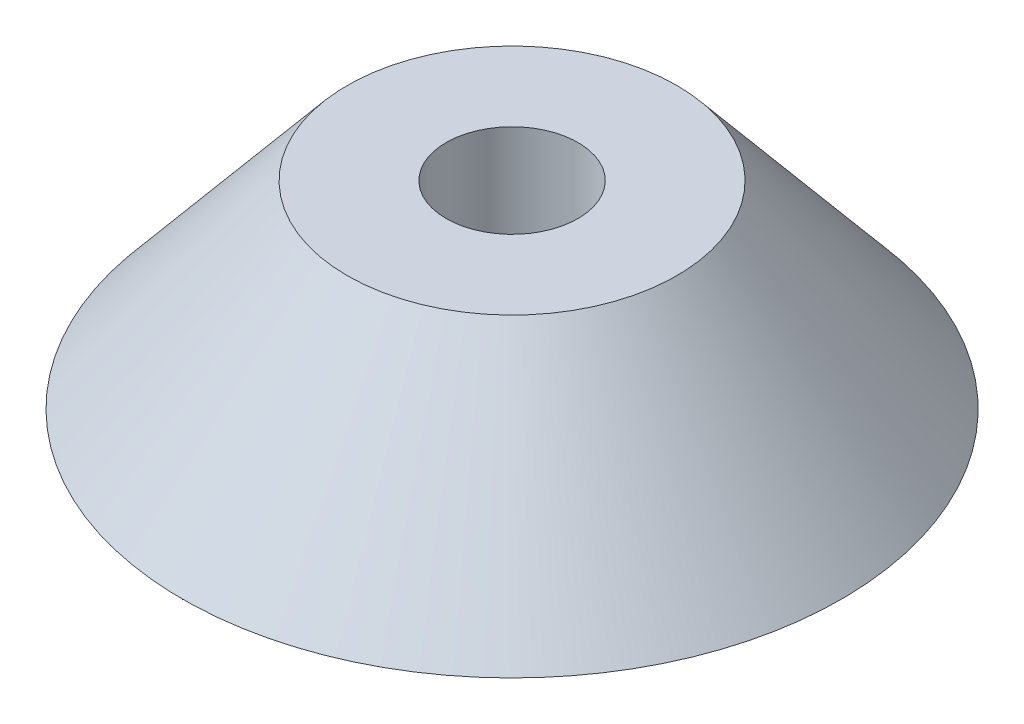
from build123d import *

# Parameters (mm, degrees)
SKETCH_2_R          = 1
CUT_EXTRUDE_1_DEPTH = 1.8
EXTRUDE_1_DEPTH     = 0.01


with BuildPart() as part:
    # 草图1 → 旋转1 (revolve)
    with BuildSketch(Plane.XY, mode=Mode.PRIVATE) as revolve_1_sk:
        Polygon((0, 0), (0, 3), (-2.5, 3), (-5, 0), align=None)
    revolve(revolve_1_sk.sketch.rotate(Axis((0, 0, 0), (0, 1, 0)), 270), axis=Axis((0, 0, 0), (0, 1, 0)))

    # 草图2 → 切除-拉伸1 (cut)
    with BuildSketch(Plane(origin=(0, 3, 0), x_dir=(1, 0, 0), z_dir=(0, 1, 0))):
        with Locations(Location((0, 0, 0), (0, 0, 270))):
            Circle(SKETCH_2_R)
    extrude(amount=-CUT_EXTRUDE_1_DEPTH, mode=Mode.SUBTRACT)


with BuildPart() as body_2:
    # 草图3 → 凸台-拉伸1 (new body)
    with BuildSketch(Plane.XZ):
        Polygon((-1.5, 0), (1.5, 0), (0, 5), align=None)
    extrude(amount=EXTRUDE_1_DEPTH)


solid = Compound([part.part, body_2.part])
